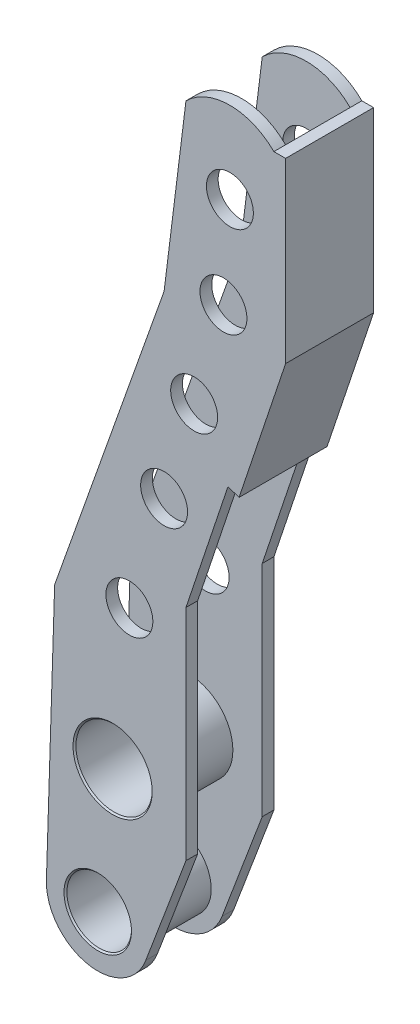
from build123d import *

# Parameters (mm, degrees)
BOSS_EXTRUDE1_START = 11
SKETCH2_R           = 12.7
SKETCH2_R_2         = 8
SKETCH2_R_3         = 15
BOSS_EXTRUDE1_DEPTH = 4
LPATTERN1_COUNT     = 2
LPATTERN1_PITCH     = 26
BOSS_EXTRUDE2_DEPTH = 15
SKETCH4_R           = 12.7
SKETCH4_R_2         = 11
SKETCH4_R_3         = 15
SKETCH4_R_4         = 13
BOSS_EXTRUDE3_DEPTH = 15
CHAMFER2_SIZE       = 0.5


with BuildPart() as part:
    # Sketch2 → Boss-Extrude1 (new body)
    with BuildSketch(Plane.XY.offset(BOSS_EXTRUDE1_START)):
        with BuildLine():
            Line((30.078103468, 30.102899094), (30.078103468, 104.858637586))
            Line((30.078103468, 104.858637586), (43.656234688, 145.478166756))
            Line((43.656234688, 145.478166756), (60.038536544, 194.486485935))
            Line((60.038536544, 194.486485935), (60.038536544, 254.427096014))
            ThreePointArc((60.038536544, 254.427096014), (45.05832001, 260.632104877), (30.078103469, 254.427096029))
            Line((30.078103469, 254.427096029), (22.62926434, 194.486485916))
            Line((22.62926434, 194.486485916), (-14.683335653, 89.230795609))
            Line((-14.683335653, 89.230795609), (-17.49123357, 0.553848547))
            ThreePointArc((-17.49123357, 0.553848547), (-3.415184823, -17.163522734), (16.370945819, -6.184022397))
            Line((16.370945819, -6.184022397), (30.078103468, 30.102899094))
        make_face()
        Circle(SKETCH2_R, mode=Mode.SUBTRACT)
        with Locations((45.058319997, 232.788133995)):
            Circle(SKETCH2_R_2, mode=Mode.SUBTRACT)
        with Locations((42.85515341, 200.574247039)):
            Circle(SKETCH2_R_2, mode=Mode.SUBTRACT)
        with Locations((32.877400798, 166.36480954)):
            Circle(SKETCH2_R_2, mode=Mode.SUBTRACT)
        with Locations((22.629264347, 133.284451418)):
            Circle(SKETCH2_R_2, mode=Mode.SUBTRACT)
        with Locations((10.792452444, 95.075946031)):
            Circle(SKETCH2_R_2, mode=Mode.SUBTRACT)
        with Locations((5.075535148, 44.712849864)):
            Circle(SKETCH2_R_3, mode=Mode.SUBTRACT)
    extrude(amount=BOSS_EXTRUDE1_DEPTH)


with BuildPart() as lpattern1_1:
    # LPattern1: pattern copy
    add(part.part.moved(Location(Vector(0, 0, -1) * (1 * LPATTERN1_PITCH))))


with BuildPart() as part_1:
    add(part.part)

    add(lpattern1_1.part)  # Boss-Extrude2 merges LPattern1_1
    # Sketch3 → Boss-Extrude2 (add, symmetric)
    with BuildSketch(Plane.XY):
        Polygon((60.038536544, 194.486485935), (60.038536544, 254.427096014), (64.038536544, 254.427096014), (64.038536544, 193.835634299), (48.186924823, 146.414896158), (44.393265771, 147.683025095), align=None)
    extrude(amount=BOSS_EXTRUDE2_DEPTH, both=True)

    # Sketch4 → Boss-Extrude3 (add, symmetric)
    # profile 1 of 2: a face of its own
    with BuildSketch(Plane.XY):
        Circle(SKETCH4_R)
        Circle(SKETCH4_R_2, mode=Mode.SUBTRACT)
    # profile 2 of 2: a face of its own
    with BuildSketch(Plane.XY):
        with Locations((5.075535148, 44.712849864)):
            Circle(SKETCH4_R_3)
        with Locations((5.075535148, 44.712849864)):
            Circle(SKETCH4_R_4, mode=Mode.SUBTRACT)
    extrude(amount=BOSS_EXTRUDE3_DEPTH, both=True)

    # Chamfer2
    chamfer2_edges = [part_1.edges().sort_by_distance(p)[0] for p in [
        (-11, 0, -15),
        (-11, 0, 15),
        (-7.924464852, 44.712849864, -15),
        (-7.924464852, 44.712849864, 15),
    ]]
    chamfer(chamfer2_edges, length=CHAMFER2_SIZE)


solid = part_1.part
